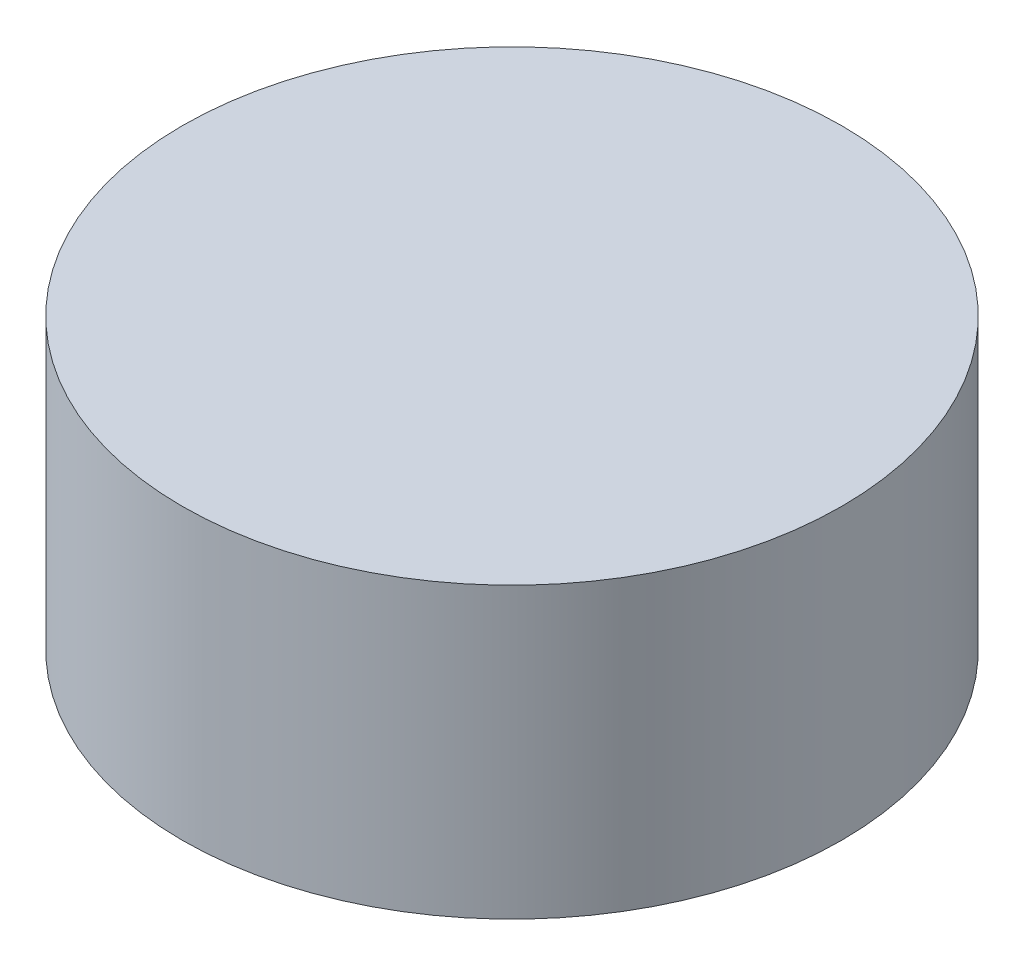
from build123d import *

# Parameters (mm, degrees)
SKETCH1_R           = 2.85
BOSS_EXTRUDE1_DEPTH = 2.5


with BuildPart() as part:
    # Sketch1 → Boss-Extrude1 (new body)
    with BuildSketch(Plane(origin=(0, 0, 0), x_dir=(1, 0, 0), z_dir=(0, 1, 0))):
        with Locations(Location((0, 0, 0), (0, 0, 270))):
            Circle(SKETCH1_R)
    extrude(amount=BOSS_EXTRUDE1_DEPTH)


solid = part.part
